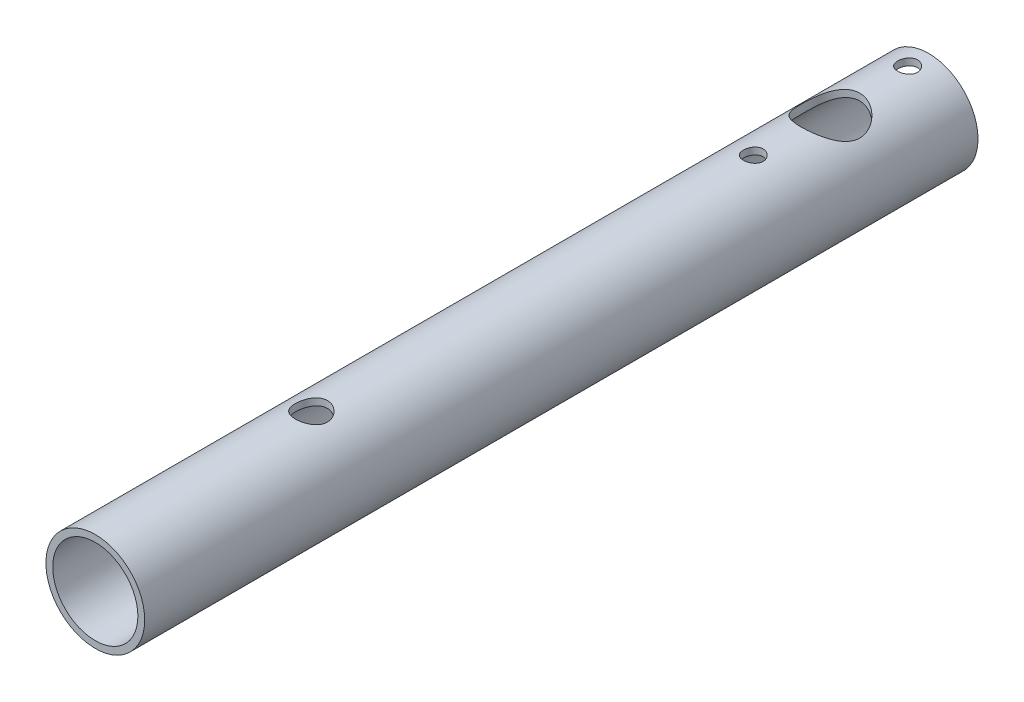
from build123d import *

# Parameters (mm, degrees)
SKETCH1_R               = 8
SKETCH1_R_2             = 6.9
BOSS_EXTRUDE1_DEPTH     = 135
CUT_EXTRUDE1_DEPTH      = 136.473244591
CUT_EXTRUDE1_DEPTH_BACK = 136.473244591
SKETCH3_R               = 2.6
SKETCH3_R_2             = 4.75
SKETCH3_R_3             = 1.6


with BuildPart() as part:
    # Sketch1 → Boss-Extrude1 (new body)
    with BuildSketch(Plane.XY):
        Circle(SKETCH1_R)
        Circle(SKETCH1_R_2, mode=Mode.SUBTRACT)
    extrude(amount=BOSS_EXTRUDE1_DEPTH)

    # Sketch3 → Cut-Extrude1 (cut, two sides: drawn at the far end of the back side and taken through both)
    with BuildSketch(Plane(origin=(0, 0, 0), x_dir=(1, 0, 0), z_dir=(0, 1, 0)).offset(-CUT_EXTRUDE1_DEPTH_BACK)):
        with Locations((0, -100)):
            Circle(SKETCH3_R)
        with Locations((0, -15.906910881)):
            Circle(SKETCH3_R_2)
        with Locations((0, -3.406910881)):
            Circle(SKETCH3_R_3)
        with Locations((0, -28.406910881)):
            Circle(SKETCH3_R_3)
    extrude(amount=CUT_EXTRUDE1_DEPTH + CUT_EXTRUDE1_DEPTH_BACK, mode=Mode.SUBTRACT)


solid = part.part
